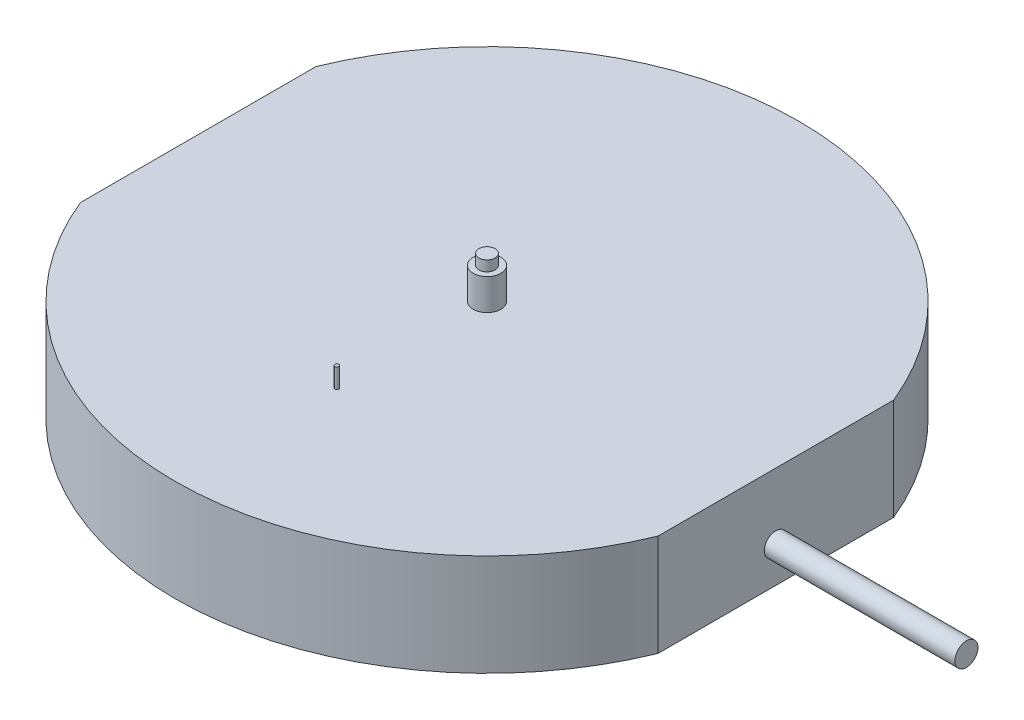
from build123d import *

# Parameters (mm, degrees)
SKETCH1_R           = 13.5
BOSS_EXTRUDE1_DEPTH = 4.4
SKETCH2_W           = 11.68560188
SKETCH2_H           = 30
SKETCH2_W_2         = 6.209334753
CUT_EXTRUDE2_DEPTH  = 4.4
SKETCH3_R           = 0.6
BOSS_EXTRUDE2_DEPTH = 1.35
SKETCH4_R           = 0.35
BOSS_EXTRUDE3_DEPTH = 0.45
SKETCH5_R           = 0.5
BOSS_EXTRUDE4_DEPTH = 8.25
SKETCH7_R           = 0.085
BOSS_EXTRUDE5_DEPTH = 0.85


with BuildPart() as part:
    # Sketch1 → Boss-Extrude1 (new body)
    with BuildSketch(Plane(origin=(0, 0, 0), x_dir=(1, 0, 0), z_dir=(0, 1, 0))):
        with Locations(Location((0, 0, 0), (0, 0, 270))):
            Circle(SKETCH1_R)
    extrude(amount=BOSS_EXTRUDE1_DEPTH)

    # Sketch2 → Cut-Extrude2 (cut)
    with BuildSketch(Plane(origin=(0, 0, 0), x_dir=(1, 0, 0), z_dir=(0, 1, 0))):
        with Locations((-18.34280094, 0)):
            Rectangle(SKETCH2_W, SKETCH2_H)
        with Locations((15.604667377, 0)):
            Rectangle(SKETCH2_W_2, SKETCH2_H)
    extrude(amount=CUT_EXTRUDE2_DEPTH, mode=Mode.SUBTRACT)

    # Sketch3 → Boss-Extrude2 (add)
    with BuildSketch(Plane(origin=(0, 4.4, 0), x_dir=(1, 0, 0), z_dir=(0, 1, 0))):
        with Locations(Location((0, 0, 0), (0, 0, 270))):
            Circle(SKETCH3_R)
    extrude(amount=BOSS_EXTRUDE2_DEPTH)

    # Sketch4 → Boss-Extrude3 (add)
    with BuildSketch(Plane(origin=(0, 5.75, 0), x_dir=(1, 0, 0), z_dir=(0, 1, 0))):
        with Locations(Location((0, 0, 0), (0, 0, 270))):
            Circle(SKETCH4_R)
    extrude(amount=BOSS_EXTRUDE3_DEPTH)

    # Sketch5 → Boss-Extrude4 (add)
    with BuildSketch(Plane(origin=(12.5, 0, 0), x_dir=(0, 0, -1), z_dir=(1, 0, 0))):
        with Locations((0, 1.55)):
            Circle(SKETCH5_R)
    extrude(amount=BOSS_EXTRUDE4_DEPTH)

    # Sketch7 → Boss-Extrude5 (add)
    with BuildSketch(Plane(origin=(0, 4.4, 0), x_dir=(1, 0, 0), z_dir=(0, 1, 0))):
        with Locations(Location((0, -6.5, 0), (0, 0, 270))):
            Circle(SKETCH7_R)
    extrude(amount=BOSS_EXTRUDE5_DEPTH)


solid = part.part
